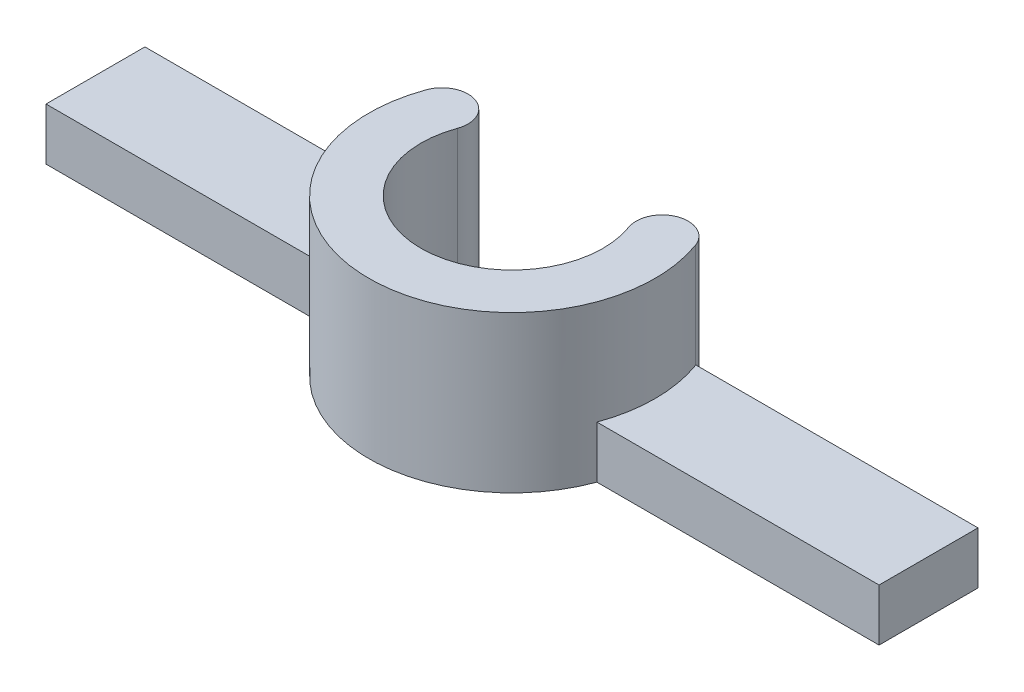
from build123d import *

# Parameters (mm, degrees)
BOSS_EXTRUDE1_DEPTH = 6
SKETCH2_W           = 11.5
SKETCH2_H           = 3.8
SKETCH2_H_2         = 1.9
BOSS_EXTRUDE2_DEPTH = 2


with BuildPart() as part:
    # Sketch1 → Boss-Extrude1 (new body)
    with BuildSketch(Plane(origin=(0, 0, 0), x_dir=(1, 0, 0), z_dir=(0, 1, 0))):
        with BuildLine():
            Line((5.5, 0), (3.5, 0))
            ThreePointArc((3.5, 0), (-0.607768622, -3.446827136), (-3.288924173, 1.197070502))
            ThreePointArc((-3.288924173, 1.197070502), (-3.88659665, 2.478783266), (-5.168309414, 1.881110788))
            ThreePointArc((-5.168309414, 1.881110788), (-0.955064977, -5.416442642), (5.5, 0))
        make_face()
        with BuildLine():
            ThreePointArc((3.288924173, 1.197070502), (3.446827136, 0.607768622), (3.5, 0))
            Line((3.5, 0), (5.5, 0))
            ThreePointArc((5.5, 0), (5.416442642, 0.955064977), (5.168309414, 1.881110788))
            Line((5.168309414, 1.881110788), (4.228616794, 1.539090645))
            Line((4.228616794, 1.539090645), (3.288924173, 1.197070502))
        make_face()
        with BuildLine():
            ThreePointArc((5.168309414, 1.881110788), (3.88659665, 2.478783266), (3.288924173, 1.197070502))
            Line((3.288924173, 1.197070502), (4.228616794, 1.539090645))
            Line((4.228616794, 1.539090645), (5.168309414, 1.881110788))
        make_face()
    extrude(amount=BOSS_EXTRUDE1_DEPTH)

    # Sketch2 → Boss-Extrude2 (add)
    with BuildSketch(Plane(origin=(0, 0, 0), x_dir=(1, 0, 0), z_dir=(0, 1, 0))):
        with Locations((-10.25, 0)):
            Rectangle(SKETCH2_W, SKETCH2_H)
        with Locations((10.25, -0.95)):
            Rectangle(SKETCH2_W, SKETCH2_H_2)
        with Locations((10.25, 0.95)):
            Rectangle(SKETCH2_W, SKETCH2_H_2)
    extrude(amount=BOSS_EXTRUDE2_DEPTH)


solid = part.part
